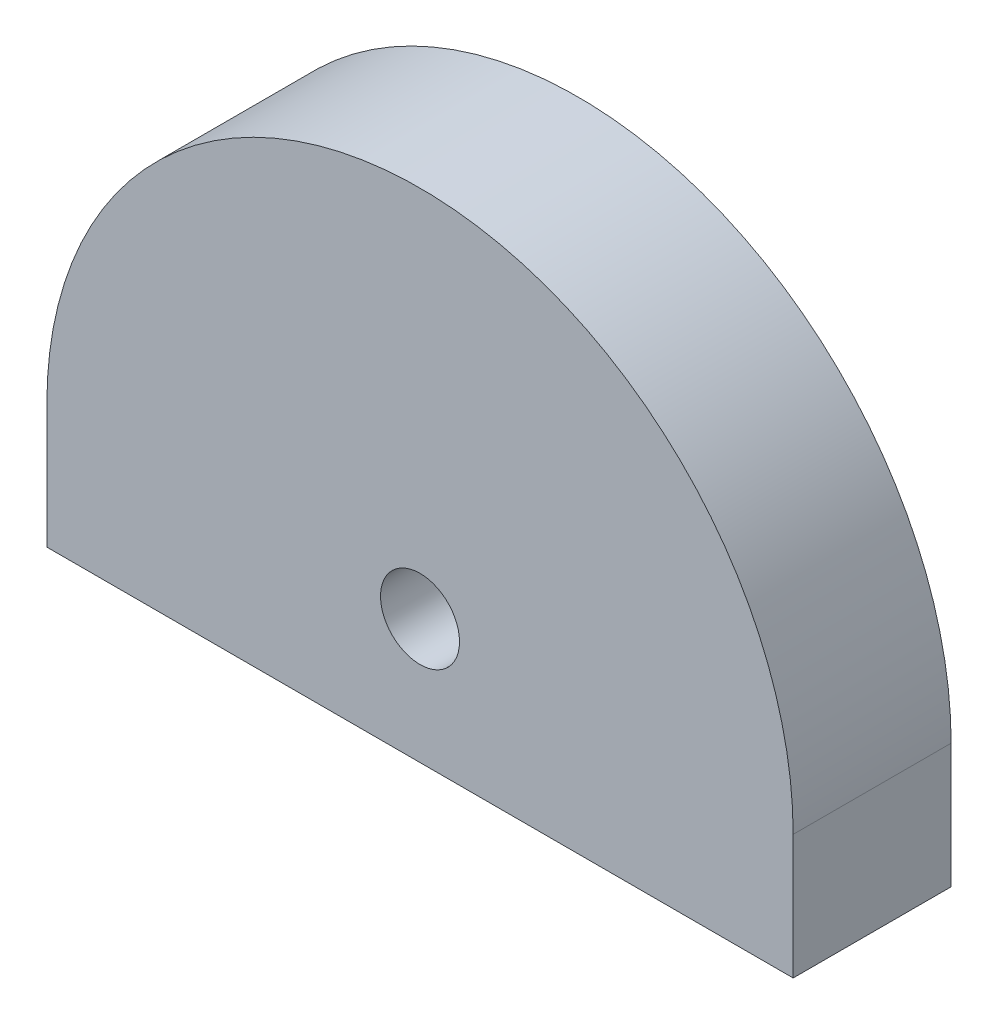
from build123d import *

# Parameters (mm, degrees)
CROQUIS1_R              = 3.175
SALIENTE_EXTRUIR1_DEPTH = 6.35


with BuildPart() as part:
    # Croquis1 → Saliente-Extruir1 (new, symmetric)
    with BuildSketch(Plane.XY):
        with BuildLine():
            Line((30, 10), (30, 0))
            Line((30, 0), (-30, 0))
            Line((-30, 0), (-30, 10))
            ThreePointArc((-30, 10), (0, 40), (30, 10))
        make_face()
        with Locations((0, 10)):
            Circle(CROQUIS1_R, mode=Mode.SUBTRACT)
    extrude(amount=SALIENTE_EXTRUIR1_DEPTH, both=True)


solid = part.part
